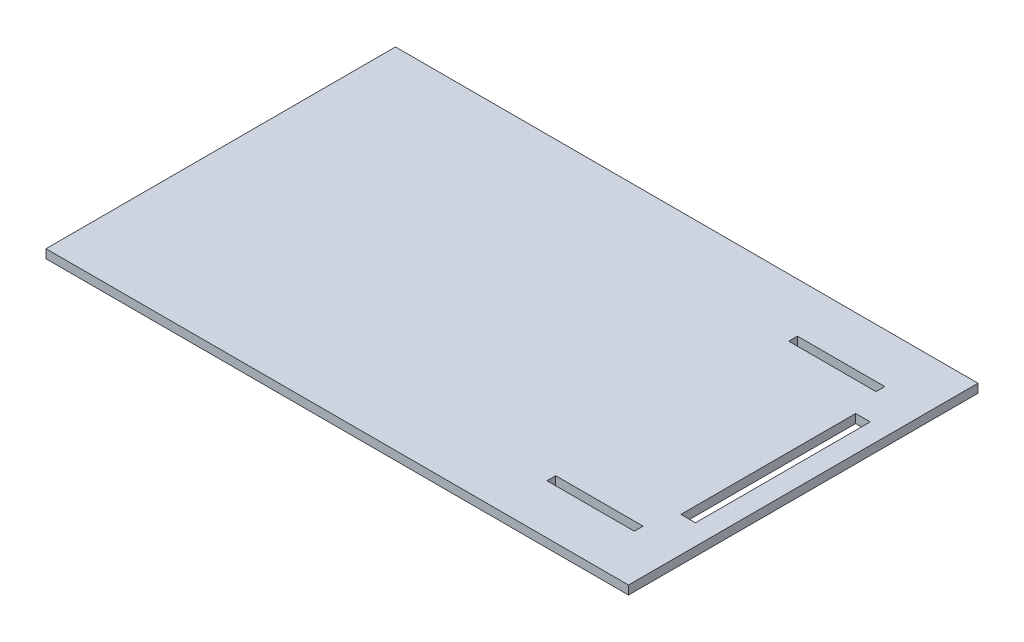
from build123d import *

# Parameters (mm, degrees)
SKETCH1_W           = 200
SKETCH1_H           = 120
BOSS_EXTRUDE1_DEPTH = 3
SKETCH2_W           = 5
SKETCH2_H           = 60
CUT_EXTRUDE1_DEPTH  = 117.657618697
SKETCH3_W           = 30
SKETCH3_H           = 3
CUT_EXTRUDE2_DEPTH  = 117.657618697


with BuildPart() as part:
    # Sketch1 → Boss-Extrude1 (new body)
    with BuildSketch(Plane(origin=(0, 0, 0), x_dir=(1, 0, 0), z_dir=(0, 1, 0))):
        Rectangle(SKETCH1_W, SKETCH1_H)
    extrude(amount=BOSS_EXTRUDE1_DEPTH)

    # Sketch2 → Cut-Extrude1 (cut, through all)
    with BuildSketch(Plane(origin=(0, 3, 0), x_dir=(1, 0, 0), z_dir=(0, 1, 0))):
        with Locations((90.5, 0)):
            Rectangle(SKETCH2_W, SKETCH2_H)
    extrude(amount=-CUT_EXTRUDE1_DEPTH, mode=Mode.SUBTRACT)

    # Sketch3 → Cut-Extrude2 (cut, through all)
    with BuildSketch(Plane(origin=(0, 3, 0), x_dir=(1, 0, 0), z_dir=(0, 1, 0))):
        with Locations((70, 41.5)):
            Rectangle(SKETCH3_W, SKETCH3_H)
        with Locations((70, -41.5)):
            Rectangle(SKETCH3_W, SKETCH3_H)
    extrude(amount=-CUT_EXTRUDE2_DEPTH, mode=Mode.SUBTRACT)


solid = part.part
